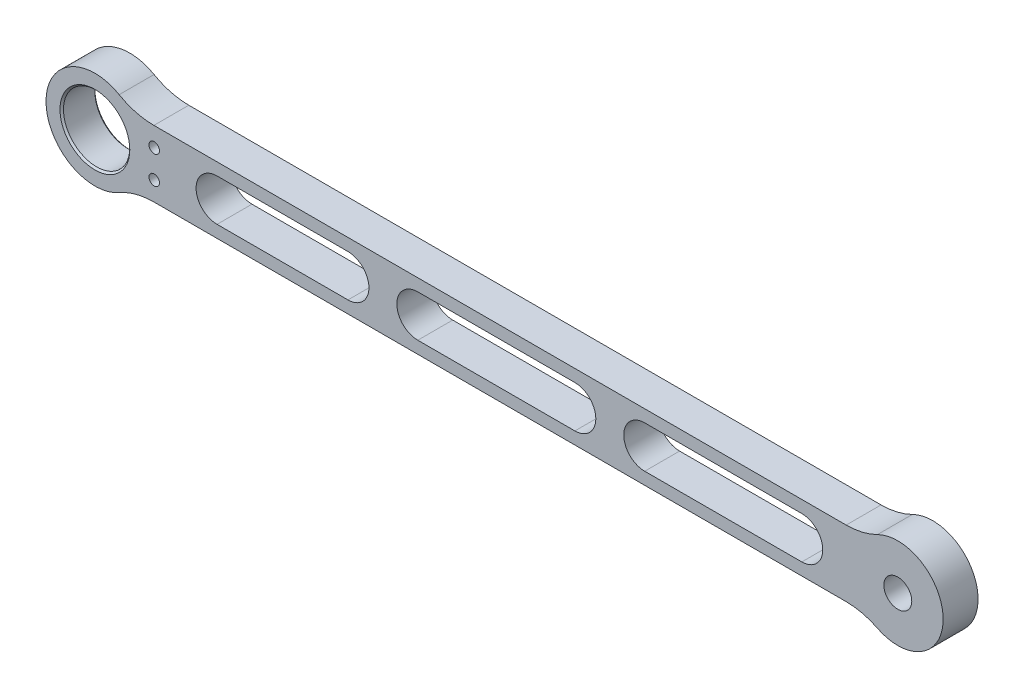
from build123d import *

# Parameters (mm, degrees)
SKETCH_1_R          = 9.5
EXTRUDE_1_DEPTH     = 10
CHAMFER_1_SIZE      = 0.5
CUT_EXTRUDE_2_DEPTH = 10
EXTRUDE_START       = -10
SKETCH_3_R          = 9.5
SKETCH_3_R_2        = 4
EXTRUDE_2_DEPTH     = 10
SKETCH_4_R          = 6
CUT_EXTRUDE_3_DEPTH = 10
SKETCH_5_R          = 6
SKETCH_5_R_2        = 4
EXTRUDE_3_DEPTH     = 10
SKETCH_6_R          = 1.5
CUT_EXTRUDE_4_DEPTH = 244.608292141


with BuildPart() as part:
    # 草图1 → 凸台-拉伸1 (new body)
    with BuildSketch(Plane.XY):
        with BuildLine():
            Line((16.904141504, -9.5), (212.802616478, -9.5))
            Line((212.802616478, -9.5), (215.209800542, -9.5))
            ThreePointArc((215.209800542, -9.5), (219.815462407, -10.037526396), (224.173557789, -11.621212121))
            ThreePointArc((224.173557789, -11.621212121), (243, 0), (224.173557789, 11.621212121))
            ThreePointArc((224.173557789, 11.621212121), (219.815462407, 10.037526396), (215.209800542, 9.5))
            Line((215.209800542, 9.5), (212.802616478, 9.5))
            Line((212.802616478, 9.5), (16.904141504, 9.5))
            ThreePointArc((16.904141504, 9.5), (11.75918395, 10.173090993), (6.960528855, 12.147058824))
            ThreePointArc((6.960528855, 12.147058824), (-14, 0), (6.960528855, -12.147058824))
            ThreePointArc((6.960528855, -12.147058824), (11.75918395, -10.173090993), (16.904141504, -9.5))
        make_face()
        Circle(SKETCH_1_R, mode=Mode.SUBTRACT)
        with Locations((230, 0)):
            Circle(SKETCH_1_R, mode=Mode.SUBTRACT)
    extrude(amount=EXTRUDE_1_DEPTH)

    # 倒角1
    chamfer_1_edges = [part.edges().sort_by_distance(p)[0] for p in [
        (-9.5, 0, 0),
        (-9.5, 0, 10),
    ]]
    chamfer(chamfer_1_edges, length=CHAMFER_1_SIZE)

    # 草图2 → 切除-拉伸2 (cut)
    with BuildSketch(Plane.XY.offset(10)):
        with BuildLine():
            Line((137.499999918, -6), (92.5, -6))
            ThreePointArc((92.5, -6), (86.5, 0), (92.5, 6))
            Line((92.5, 6), (137.499999918, 6))
            ThreePointArc((137.499999918, 6), (143.499999918, 0), (137.499999918, -6))
        make_face()
        with BuildLine():
            Line((35, -6), (72.5, -6))
            ThreePointArc((72.5, -6), (78.5, 0), (72.5, 6))
            Line((72.5, 6), (35, 6))
            ThreePointArc((35, 6), (29, 0), (35, -6))
        make_face()
        with BuildLine():
            Line((157.5, -6), (202.5, -6))
            ThreePointArc((202.5, -6), (208.5, 0), (202.5, 6))
            Line((202.5, 6), (157.5, 6))
            ThreePointArc((157.5, 6), (151.5, 0), (157.5, -6))
        make_face()
    extrude(amount=-CUT_EXTRUDE_2_DEPTH, mode=Mode.SUBTRACT)

    # 草图3 → 凸台-拉伸2 (add)
    with BuildSketch(Plane.XY.offset(10).offset(EXTRUDE_START)):
        with Locations((230, 0)):
            Circle(SKETCH_3_R)
        with Locations((230, 0)):
            Circle(SKETCH_3_R_2, mode=Mode.SUBTRACT)
    extrude(amount=EXTRUDE_2_DEPTH)

    # 草图4 → 切除-拉伸3 (cut)
    with BuildSketch(Plane.XY.offset(10)):
        with Locations((230, 0)):
            Circle(SKETCH_4_R)
    extrude(amount=-CUT_EXTRUDE_3_DEPTH, mode=Mode.SUBTRACT)

    # 草图5 → 凸台-拉伸3 (add)
    with BuildSketch(Plane.XY.offset(10)):
        with Locations((230, 0)):
            Circle(SKETCH_5_R)
        with Locations((230, 0)):
            Circle(SKETCH_5_R_2, mode=Mode.SUBTRACT)
    extrude(amount=-EXTRUDE_3_DEPTH)

    # 草图6 → 切除-拉伸4 (cut, through all)
    with BuildSketch(Plane.XY.offset(10)):
        with Locations((17, 4)):
            Circle(SKETCH_6_R)
        with Locations((17, -4)):
            Circle(SKETCH_6_R)
    extrude(amount=-CUT_EXTRUDE_4_DEPTH, mode=Mode.SUBTRACT)


solid = part.part
